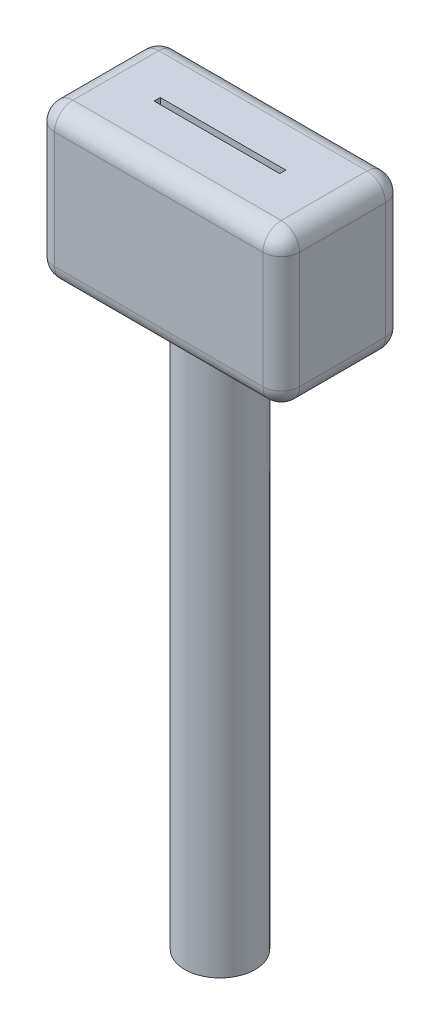
from build123d import *

# Parameters (mm, degrees)
SKETCH_1_R          = 5.75
EXTRUDE_1_DEPTH     = 90
SKETCH_2_W          = 40
SKETCH_2_H          = 20
EXTRUDE_2_DEPTH     = 25
SKETCH_3_W          = 20.5
SKETCH_3_H          = 1
CUT_EXTRUDE_1_DEPTH = 20
FILLET_1_R          = 3


with BuildPart() as part:
    # 草图1 → 凸台-拉伸1 (new body)
    with BuildSketch(Plane(origin=(0, 0, 0), x_dir=(1, 0, 0), z_dir=(0, 1, 0))):
        with Locations(Location((0, 0, 0), (0, 0, 90))):
            Circle(SKETCH_1_R)
    extrude(amount=EXTRUDE_1_DEPTH)

    # 草图2 → 凸台-拉伸2 (add)
    with BuildSketch(Plane(origin=(0, 90, 0), x_dir=(1, 0, 0), z_dir=(0, 1, 0))):
        Rectangle(SKETCH_2_W, SKETCH_2_H)
    extrude(amount=EXTRUDE_2_DEPTH)

    # 草图3 → 切除-拉伸1 (cut)
    with BuildSketch(Plane(origin=(0, 115, 0), x_dir=(1, 0, 0), z_dir=(0, 1, 0))):
        Rectangle(SKETCH_3_W, SKETCH_3_H)
    extrude(amount=-CUT_EXTRUDE_1_DEPTH, mode=Mode.SUBTRACT)

    # 圆角1
    fillet_1_edges = [part.edges().sort_by_distance(p)[0] for p in [
        (20, 90, 0),
        (20, 102.5, 10),
        (0, 90, -10),
        (20, 102.5, -10),
        (-20, 90, 0),
        (-20, 102.5, -10),
        (0, 90, 10),
        (-20, 102.5, 10),
        (20, 115, 0),
        (0, 115, -10),
        (-20, 115, 0),
        (0, 115, 10),
    ]]
    fillet(fillet_1_edges, radius=FILLET_1_R)


solid = part.part
